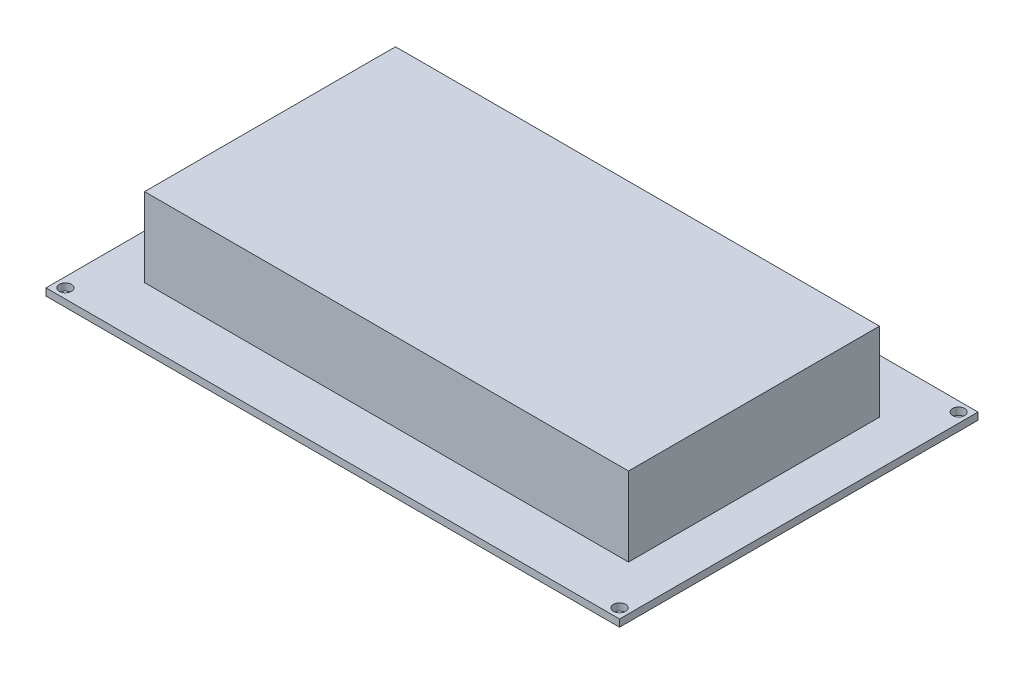
from build123d import *

# Parameters (mm, degrees)
SKETCH_1_W          = 160
SKETCH_1_H          = 100
EXTRUDE_1_DEPTH     = 2
SKETCH_2_R          = 1.7
CUT_EXTRUDE_1_DEPTH = 95.361008897
SKETCH_3_W          = 135
SKETCH_3_H          = 70
EXTRUDE_2_DEPTH     = 22


with BuildPart() as part:
    # 스케치1 → 보스-돌출1 (new body)
    with BuildSketch(Plane(origin=(0, 0, 0), x_dir=(1, 0, 0), z_dir=(0, 1, 0))):
        Rectangle(SKETCH_1_W, SKETCH_1_H)
    extrude(amount=EXTRUDE_1_DEPTH)

    # 스케치2 → 컷-돌출1 (cut, through all)
    with BuildSketch(Plane(origin=(0, 2, 0), x_dir=(1, 0, 0), z_dir=(0, 1, 0))):
        with Locations(Location((77.3, 47.3, 0), (0, 0, 270))):
            Circle(SKETCH_2_R)
        with Locations(Location((77.3, -47.3, 0), (0, 0, 90))):
            Circle(SKETCH_2_R)
        with Locations(Location((-77.3, -47.3, 0), (0, 0, 270))):
            Circle(SKETCH_2_R)
        with Locations(Location((-77.3, 47.3, 0), (0, 0, 90))):
            Circle(SKETCH_2_R)
    extrude(amount=-CUT_EXTRUDE_1_DEPTH, mode=Mode.SUBTRACT)

    # 스케치3 → 보스-돌출2 (add)
    with BuildSketch(Plane(origin=(0, 2, 0), x_dir=(1, 0, 0), z_dir=(0, 1, 0))):
        Rectangle(SKETCH_3_W, SKETCH_3_H)
    extrude(amount=EXTRUDE_2_DEPTH)


solid = part.part
